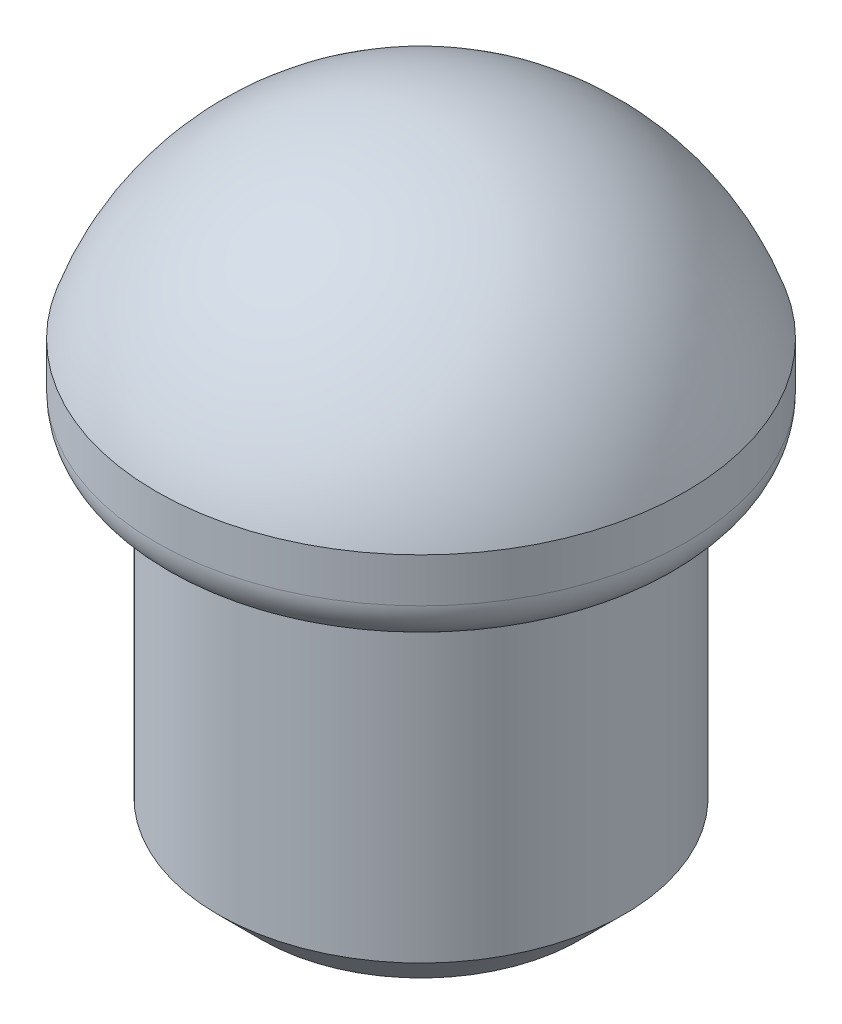
from build123d import *

# Parameters (mm, degrees)
SKETCH1_R           = 2.3
BOSS_EXTRUDE1_DEPTH = 4
FILLET1_R           = 0.5
CHAMFER1_SIZE       = 0.5


with BuildPart() as part:
    # Sketch1 → Boss-Extrude1 (new body)
    with BuildSketch(Plane(origin=(0, 0, 0), x_dir=(1, 0, 0), z_dir=(0, 1, 0))):
        with Locations(Location((0, 0, 0), (0, 0, 270))):
            Circle(SKETCH1_R)
    extrude(amount=BOSS_EXTRUDE1_DEPTH)

    # Sketch2 → Revolve1 (revolve)
    with BuildSketch(Plane.XY, mode=Mode.PRIVATE) as revolve1_sk:
        with BuildLine():
            Line((-3, 5), (-3, 4))
            Line((-3, 4), (0, 4))
            Line((0, 4), (0, 7.16227766))
            ThreePointArc((0, 7.16227766), (-1.849016271, 6.565373039), (-3, 5))
        make_face()
    revolve(revolve1_sk.sketch.rotate(Axis((0, -2.040480146, 0), (0, 1, 0)), 180), axis=Axis((0, -2.040480146, 0), (0, 1, 0)))

    # Fillet1
    fillet1_edges = [part.edges().sort_by_distance(p)[0] for p in [
        (-3, 4, 0),
    ]]
    fillet(fillet1_edges, radius=FILLET1_R)

    # Chamfer1
    chamfer1_edges = [part.edges().sort_by_distance(p)[0] for p in [
        (0, 0, -2.3),
    ]]
    chamfer(chamfer1_edges, length=CHAMFER1_SIZE)


solid = part.part
